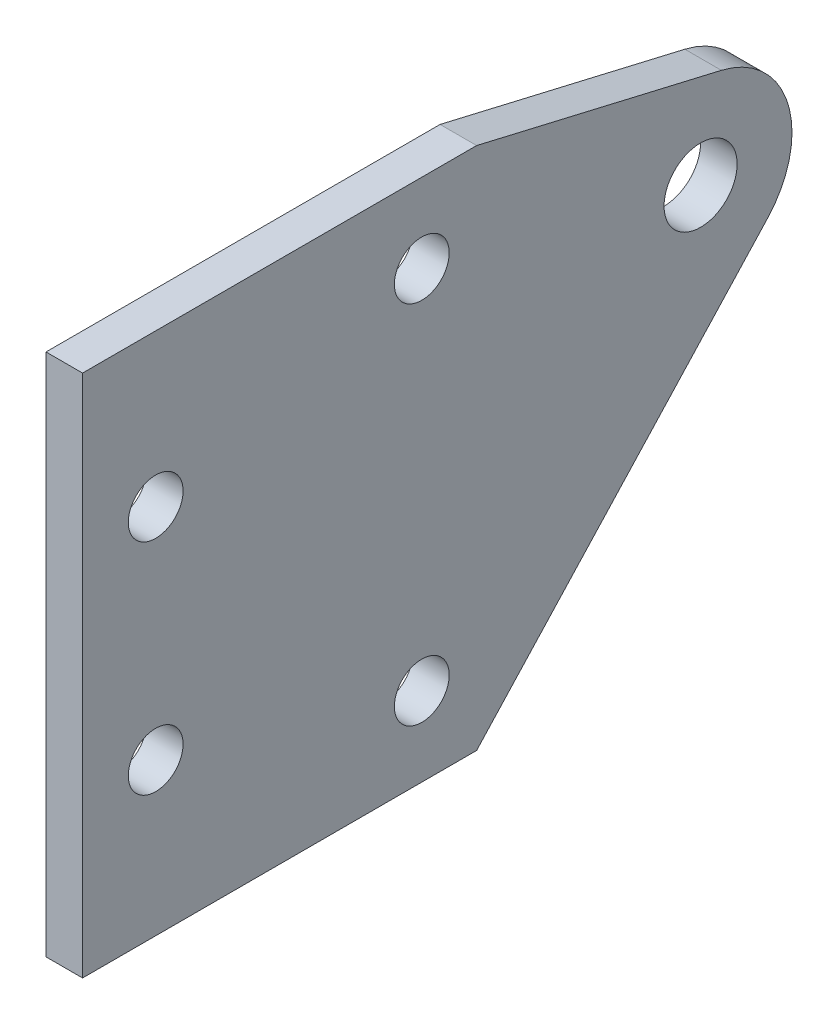
from build123d import *

# Parameters (mm, degrees)
SKETCH1_R           = 2.38125
SKETCH1_R_2         = 3.175
BOSS_EXTRUDE1_DEPTH = 3.175


with BuildPart() as part:
    # Sketch1 → Boss-Extrude1 (new body)
    with BuildSketch(Plane.ZY.offset(25.4)):
        with BuildLine():
            Line((-54.275, 379.360683619), (-88.4975, 379.360683619))
            Line((-88.4975, 379.360683619), (-109.757210754, 374.389713024))
            ThreePointArc((-109.757210754, 374.389713024), (-115.537519793, 368.991659734), (-113.784858038, 361.279388429))
            Line((-113.784858038, 361.279388429), (-88.4975, 333.860683619))
            Line((-88.4975, 333.860683619), (-54.275, 333.860683619))
            Line((-54.275, 333.860683619), (-54.275, 379.360683619))
        make_face()
        with Locations((-83.735, 372.485683619)):
            Circle(SKETCH1_R, mode=Mode.SUBTRACT)
        with Locations((-83.735, 340.735683619)):
            Circle(SKETCH1_R, mode=Mode.SUBTRACT)
        with Locations((-60.625, 366.135683619)):
            Circle(SKETCH1_R, mode=Mode.SUBTRACT)
        with Locations((-60.625, 347.085683619)):
            Circle(SKETCH1_R, mode=Mode.SUBTRACT)
        with Locations((-107.95, 366.660683619)):
            Circle(SKETCH1_R_2, mode=Mode.SUBTRACT)
    extrude(amount=BOSS_EXTRUDE1_DEPTH)


solid = part.part
